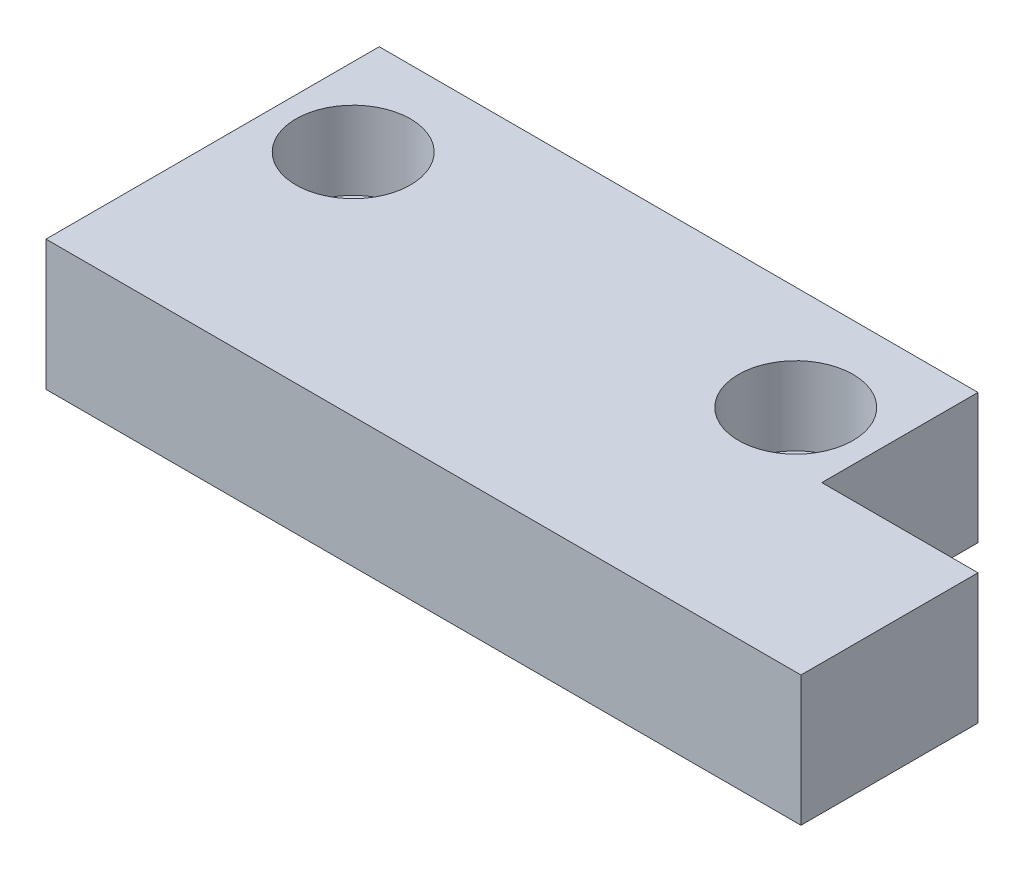
from build123d import *

# Parameters (mm, degrees)
SKETCH_1_W          = 35
SKETCH_1_H          = 20
EXTRUDE_1_DEPTH     = 5
SKETCH_3_W          = 29
SKETCH_3_H          = 7.2
CUT_EXTRUDE_4_DEPTH = 5
SKETCH_4_W          = 6
SKETCH_4_H          = 6
CUT_EXTRUDE_5_DEPTH = 5
SKETCH_5_R          = 1.2
CUT_EXTRUDE_6_DEPTH = 41.620192023
CUT_EXTRUDE_START   = 5
SKETCH_7_R          = 2.2
CUT_EXTRUDE_8_DEPTH = 3
SKETCH_8_W          = 6
SKETCH_8_H          = 20
CUT_EXTRUDE_9_DEPTH = 10


with BuildPart() as part:
    # 草圖1 → 填料-伸長1 (new body)
    with BuildSketch(Plane(origin=(0, 0, 0), x_dir=(1, 0, 0), z_dir=(0, 1, 0))):
        with Locations((17.5, 10)):
            Rectangle(SKETCH_1_W, SKETCH_1_H)
    extrude(amount=EXTRUDE_1_DEPTH)

    # 草圖3 → 除料-伸長4 (cut)
    with BuildSketch(Plane(origin=(0, 0, 0), x_dir=(1, 0, 0), z_dir=(0, 1, 0))):
        with Locations((20.5, 3.6)):
            Rectangle(SKETCH_3_W, SKETCH_3_H)
    extrude(amount=CUT_EXTRUDE_4_DEPTH, mode=Mode.SUBTRACT)

    # 草圖4 → 除料-伸長5 (cut)
    with BuildSketch(Plane(origin=(0, 0, 0), x_dir=(1, 0, 0), z_dir=(0, 1, 0))):
        with Locations((32, 17)):
            Rectangle(SKETCH_4_W, SKETCH_4_H)
    extrude(amount=CUT_EXTRUDE_5_DEPTH, mode=Mode.SUBTRACT)

    # 草圖5 → 除料-伸長6 (cut, through all)
    with BuildSketch(Plane(origin=(0, 0, 0), x_dir=(1, 0, 0), z_dir=(0, 1, 0))):
        with Locations(Location((3, 16, 0), (0, 0, 270))):
            Circle(SKETCH_5_R)
        with Locations(Location((3, 4, 0), (0, 0, 270))):
            Circle(SKETCH_5_R)
        with Locations(Location((9, 16, 0), (0, 0, 270))):
            Circle(SKETCH_5_R)
        with Locations(Location((26, 16, 0), (0, 0, 270))):
            Circle(SKETCH_5_R)
    extrude(amount=CUT_EXTRUDE_6_DEPTH, mode=Mode.SUBTRACT)

    # 草圖7 → 除料-伸長8 (cut)
    with BuildSketch(Plane(origin=(0, 0, 0), x_dir=(1, 0, 0), z_dir=(0, 1, 0)).offset(CUT_EXTRUDE_START)):
        with Locations(Location((9, 16, 0), (0, 0, 90))):
            Circle(SKETCH_7_R)
        with Locations(Location((26, 16, 0), (0, 0, 90))):
            Circle(SKETCH_7_R)
    extrude(amount=-CUT_EXTRUDE_8_DEPTH, mode=Mode.SUBTRACT)

    # 草圖8 → 除料-伸長9 (cut)
    with BuildSketch(Plane(origin=(0, 5, 0), x_dir=(1, 0, 0), z_dir=(0, 1, 0))):
        with Locations((3, 10)):
            Rectangle(SKETCH_8_W, SKETCH_8_H)
    extrude(amount=-CUT_EXTRUDE_9_DEPTH, mode=Mode.SUBTRACT)


solid = part.part
